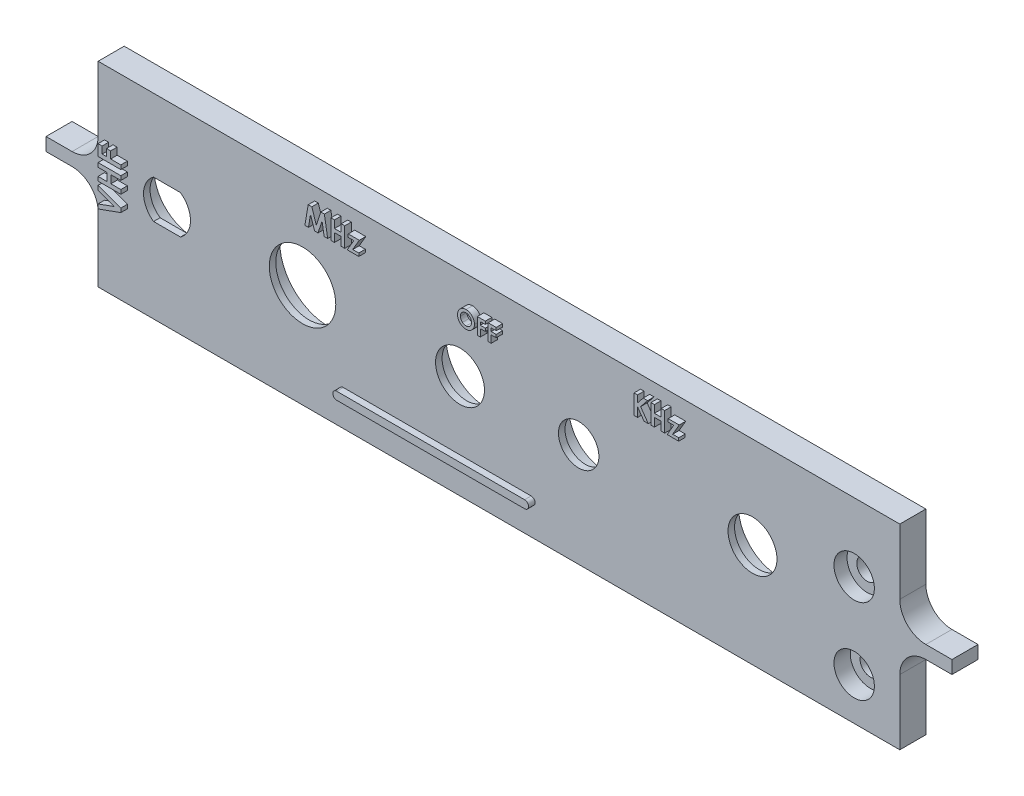
from build123d import *

# Parameters (mm, degrees)
SKETCH1_R           = 1.6
SKETCH1_R_2         = 3.75
SKETCH1_R_3         = 3.1
SKETCH1_R_4         = 5.1
BOSS_EXTRUDE1_DEPTH = 4
TEXTOS_DEPTH        = 1
SKETCH5_R           = 6
SKETCH5_R_2         = 7.5
SKETCH5_R_3         = 6.15
SKETCH5_R_4         = 5.5
CUT_EXTRUDE1_DEPTH  = 3
SKETCH6_R           = 3.1
CUT_EXTRUDE2_DEPTH  = 2
SKETCH6_3_R         = 3.1
SKETCH6_3_R_2       = 0.1
CUT_EXTRUDE3_DEPTH  = 2.5


with BuildPart() as part:
    # Sketch1 → Boss-Extrude1 (new body)
    with BuildSketch(Plane.XY):
        with BuildLine():
            Line((8, 0), (131, 0))
            Line((131, 0), (131, 10))
            ThreePointArc((131, 10), (132.171572875, 12.828427125), (135, 14))
            Line((135, 14), (139, 14))
            Line((139, 14), (139, 16))
            Line((139, 16), (135, 16))
            ThreePointArc((135, 16), (132.171572875, 17.171572875), (131, 20))
            Line((131, 20), (131, 30))
            Line((131, 30), (8, 30))
            Line((8, 30), (8, 20))
            ThreePointArc((8, 20), (6.828427125, 17.171572875), (4, 16))
            Line((4, 16), (0, 16))
            Line((0, 16), (0, 14))
            Line((0, 14), (4, 14))
            ThreePointArc((4, 14), (6.828427125, 12.828427125), (8, 10))
            Line((8, 10), (8, 0))
        make_face()
        with Locations((124, 19.5)):
            Circle(SKETCH1_R, mode=Mode.SUBTRACT)
        with Locations((108.399727047, 15.906458033)):
            Circle(SKETCH1_R_2, mode=Mode.SUBTRACT)
        with Locations((81.730883445, 15.906458033)):
            Circle(SKETCH1_R_3, mode=Mode.SUBTRACT)
        with Locations((63.522500572, 15.906458033)):
            Circle(SKETCH1_R_2, mode=Mode.SUBTRACT)
        with Locations((39.361239448, 15.906458033)):
            Circle(SKETCH1_R_4, mode=Mode.SUBTRACT)
        with Locations((124, 6.5)):
            Circle(SKETCH1_R, mode=Mode.SUBTRACT)
        with BuildLine():
            Line((16.505280772, 12.956458033), (20.632022828, 12.956458033))
            ThreePointArc((20.632022828, 12.956458033), (22.1686518, 15.906458033), (20.632022828, 18.856458033))
            Line((20.632022828, 18.856458033), (16.505280772, 18.856458033))
            ThreePointArc((16.505280772, 18.856458033), (14.9686518, 15.906458033), (16.505280772, 12.956458033))
        make_face(mode=Mode.SUBTRACT)
    extrude(amount=BOSS_EXTRUDE1_DEPTH)

    # Sketch4 → Textos (add)
    # profile 1 of 13: a face of its own
    with BuildSketch(Plane.XY.offset(4)):
        with BuildLine():
            Line((45.611678431, 4.253639523), (74.442135338, 4.253639523))
            ThreePointArc((74.442135338, 4.253639523), (75.042135338, 4.853639523), (74.442135338, 5.453639523))
            Line((74.442135338, 5.453639523), (45.611678431, 5.453639523))
            ThreePointArc((45.611678431, 5.453639523), (45.011678431, 4.853639523), (45.611678431, 4.253639523))
        make_face()
    # profile 2 of 13: a face of its own
    with BuildSketch(Plane.XY.offset(4)):
        Polygon((8.98385161, 18.336657969), (8.98385161, 20.041786174), (9.612056738, 20.041786174), (9.612056738, 18.964863097), (10.285133661, 18.964863097), (10.285133661, 20.041786174), (10.913338789, 20.041786174), (10.913338789, 18.964863097), (12.48385161, 18.964863097), (12.48385161, 18.336657969), align=None)
    # profile 3 of 13: a face of its own
    with BuildSketch(Plane.XY.offset(4)):
        Polygon((8.98385161, 15.061016943), (8.98385161, 15.689222071), (10.330005456, 15.689222071), (10.330005456, 16.900760533), (8.98385161, 16.900760533), (8.98385161, 17.528965661), (12.48385161, 17.528965661), (12.48385161, 16.900760533), (10.958210584, 16.900760533), (10.958210584, 15.689222071), (12.48385161, 15.689222071), (12.48385161, 15.061016943), align=None)
    # profile 4 of 13: a face of its own
    with BuildSketch(Plane.XY.offset(4)):
        Polygon((8.98385161, 11.359093866), (8.98385161, 12.030067424), (11.470029494, 12.929606687), (8.98385161, 13.829847071), (8.98385161, 14.500119507), (12.48385161, 13.23179018), (12.48385161, 12.62602095), align=None)
    # profile 5 of 13: a face of its own
    with BuildSketch(Plane.XY.offset(4)):
        with BuildLine():
            add(Edge.make_bspline(
                [(65.445649566, 26.23282431), (65.48911513, 26.231698909), (65.574925998, 26.229477111), (65.701122819, 26.210956699), (65.82273679, 26.180780342), (65.939712916, 26.138833024), (66.051758305, 26.083978597), (66.159268176, 26.017772221), (66.261857435, 25.938964289), (66.35847483, 25.849393262), (66.447766728, 25.751988681), (66.525138209, 25.647115332), (66.59111777, 25.53749059), (66.645801807, 25.422820711), (66.687453879, 25.302311552), (66.716682861, 25.17657755), (66.735461034, 25.045654476), (66.737620813, 24.956513707), (66.738718477, 24.911209726)],
                knots=[0, 0, 0, 0, 1.014329547, 2.002516266, 2.970391464, 3.935626869, 4.897733899, 5.877609409, 6.878433252, 7.912639331, 8.949961323, 9.958554974, 10.949718813, 11.932905612, 12.9188844, 13.919928257, 14.942845884, 16, 16, 16, 16], degree=3))
            add(Edge.make_bspline(
                [(66.738718477, 24.911209726), (66.737549512, 24.866416217), (66.735246031, 24.778149169), (66.717449469, 24.648432602), (66.687728267, 24.524045474), (66.646782646, 24.40470623), (66.593090371, 24.290992909), (66.528397483, 24.182179468), (66.450996861, 24.079275722), (66.363711607, 23.982336891), (66.267618118, 23.894344102), (66.165839859, 23.816800608), (66.058846778, 23.751093177), (65.94679548, 23.697251908), (65.829445675, 23.655467681), (65.707087233, 23.625985873), (65.579727724, 23.608069183), (65.493117081, 23.605780748), (65.449155175, 23.604619182)],
                knots=[0, 0, 0, 0, 1.051557043, 2.072126891, 3.067553643, 4.050577992, 5.02905126, 6.015227836, 7.017913613, 8.04756643, 9.074058332, 10.072836633, 11.047628519, 12.017157415, 12.98668631, 13.966869689, 14.968021931, 16, 16, 16, 16], degree=3))
            add(Edge.make_bspline(
                [(65.449155175, 23.604619182), (65.403176293, 23.605661164), (65.312834074, 23.607708516), (65.180617832, 23.627177901), (65.053943248, 23.656505596), (64.933874461, 23.700275608), (64.819188673, 23.754991804), (64.710728514, 23.822378079), (64.608530435, 23.902323073), (64.513180659, 23.992779364), (64.426793532, 24.091758387), (64.350539947, 24.196320947), (64.286218357, 24.305668279), (64.233826407, 24.419851559), (64.192522699, 24.538161166), (64.163387626, 24.66131764), (64.146176843, 24.789025607), (64.143779481, 24.87576741), (64.142564631, 24.919723348)],
                knots=[0, 0, 0, 0, 1.067978421, 2.098431617, 3.099715153, 4.085208694, 5.062210972, 6.048429807, 7.046490867, 8.072918869, 9.098532598, 10.095778865, 11.076610158, 12.041847152, 13.011192615, 13.984257998, 14.978533688, 16, 16, 16, 16], degree=3))
            add(Edge.make_bspline(
                [(64.142564631, 24.919723348), (64.142945921, 24.949294602), (64.143703673, 25.00806267), (64.152831593, 25.095153947), (64.165973175, 25.180545319), (64.18540895, 25.26389633), (64.20901845, 25.345794982), (64.239607892, 25.425478942), (64.274426955, 25.503799454), (64.315109752, 25.579831455), (64.360345089, 25.652875387), (64.409700868, 25.722586688), (64.463301196, 25.788122448), (64.520973406, 25.84991334), (64.582916245, 25.907553209), (64.64831492, 25.961858026), (64.718437784, 26.011385263), (64.791750066, 26.057344474), (64.867838451, 26.098904592), (64.946393188, 26.134279321), (65.025795895, 26.165171469), (65.107107285, 26.189552919), (65.189455962, 26.209411354), (65.273721655, 26.222544078), (65.35914307, 26.231671746), (65.416745635, 26.23243921), (65.445649566, 26.23282431)],
                knots=[0, 0, 0, 0, 1.034744296, 2.056386356, 3.06226378, 4.057406941, 5.050368692, 6.043467995, 7.042652155, 8.049140477, 9.059438543, 10.048523776, 11.036952808, 12.020949711, 13.004946614, 13.997082645, 14.994316842, 16.007702937, 17.024872941, 18.026463647, 19.021641123, 20.005082605, 20.995858141, 21.984425357, 22.988620895, 24, 24, 24, 24], degree=3))
        make_face()
        with BuildLine():
            add(Edge.make_bspline(
                [(65.438638348, 25.784106361), (65.40938603, 25.783321456), (65.351653658, 25.781772367), (65.266970783, 25.769970402), (65.185672233, 25.751121324), (65.108208676, 25.723818665), (65.034244381, 25.689069309), (64.96364823, 25.646994674), (64.897397835, 25.596148494), (64.834609811, 25.539260471), (64.777891163, 25.47587414), (64.727778448, 25.407944906), (64.685842177, 25.335586211), (64.650720287, 25.259470249), (64.624281288, 25.178741116), (64.605449582, 25.094031172), (64.593548647, 25.005194459), (64.592048519, 24.944634587), (64.591282579, 24.913713733)],
                knots=[0, 0, 0, 0, 1.033739768, 2.040188636, 3.016340934, 3.979330865, 4.937572243, 5.900995986, 6.878200029, 7.884839167, 8.891893314, 9.879764717, 10.863503415, 11.843163062, 12.837761627, 13.859916423, 14.907309254, 16, 16, 16, 16], degree=3))
            add(Edge.make_bspline(
                [(64.591282579, 24.913713733), (64.592298099, 24.879446471), (64.594288349, 24.812288316), (64.60829199, 24.714319809), (64.632250825, 24.621798277), (64.666846918, 24.53517623), (64.70975515, 24.453491794), (64.763040364, 24.377746129), (64.825839592, 24.307485704), (64.874219608, 24.266464742), (64.898774566, 24.245644823)],
                knots=[0, 0, 0, 0, 1.078454662, 2.113592447, 3.107694534, 4.079536787, 5.043276885, 6.005368276, 6.987637804, 8, 8, 8, 8], degree=3))
            add(Edge.make_bspline(
                [(64.898774566, 24.245644823), (64.918889765, 24.230263866), (64.958666964, 24.199848488), (65.022160034, 24.160864942), (65.087545394, 24.127452153), (65.155316458, 24.100455016), (65.225330097, 24.079219521), (65.29757671, 24.064348654), (65.37195393, 24.055015898), (65.422251292, 24.053900457), (65.447652772, 24.05333713)],
                knots=[0, 0, 0, 0, 1.023928204, 2.024787132, 3.009472467, 3.9914905, 4.972207045, 5.96565515, 6.972602802, 8, 8, 8, 8], degree=3))
            add(Edge.make_bspline(
                [(65.447652772, 24.05333713), (65.476402096, 24.054128691), (65.532967296, 24.055686111), (65.616073754, 24.067342787), (65.695692264, 24.08707009), (65.772317106, 24.114133241), (65.845727327, 24.149318905), (65.915564153, 24.192698563), (65.981950025, 24.243739567), (66.044658058, 24.301374654), (66.101976165, 24.365010683), (66.151984305, 24.433302244), (66.19525394, 24.50474467), (66.229645469, 24.580349119), (66.257129013, 24.65940192), (66.275734069, 24.742253183), (66.287735541, 24.828561362), (66.289236091, 24.887297128), (66.290000528, 24.917219342)],
                knots=[0, 0, 0, 0, 1.026359118, 2.019393844, 2.989460624, 3.950973911, 4.916101784, 5.890408035, 6.881132271, 7.902007068, 8.92769091, 9.933912415, 10.920395702, 11.90457117, 12.894218921, 13.903490204, 14.931958862, 16, 16, 16, 16], degree=3))
            add(Edge.make_bspline(
                [(66.290000528, 24.917219342), (66.289209641, 24.946969495), (66.287652902, 25.005528133), (66.27597571, 25.091614415), (66.256373512, 25.174099913), (66.229229093, 25.253119337), (66.194567108, 25.328750153), (66.151704047, 25.400726401), (66.100790311, 25.468978495), (66.042997677, 25.533041324), (65.980093947, 25.591910961), (65.912560507, 25.642999104), (65.84228702, 25.687393076), (65.767661067, 25.722169522), (65.690209435, 25.749875842), (65.609459508, 25.770279173), (65.525105442, 25.781689457), (65.467717627, 25.783293545), (65.438638348, 25.784106361)],
                knots=[0, 0, 0, 0, 1.055025985, 2.07665775, 3.074803781, 4.057872707, 5.035505728, 6.020516407, 7.023567878, 8.050795229, 9.077271434, 10.074415901, 11.050397877, 12.019801805, 12.988065821, 13.964604439, 14.968634123, 16, 16, 16, 16], degree=3))
        make_face(mode=Mode.SUBTRACT)
    # profile 6 of 13: a face of its own
    with BuildSketch(Plane.XY.offset(4)):
        Polygon((67.187436425, 26.168721746), (68.405385143, 26.168721746), (68.405385143, 25.720003797), (67.636154374, 25.720003797), (67.636154374, 25.239234566), (68.405385143, 25.239234566), (68.405385143, 24.790516618), (67.636154374, 24.790516618), (67.636154374, 23.668721746), (67.187436425, 23.668721746), align=None)
    # profile 7 of 13: a face of its own
    with BuildSketch(Plane.XY.offset(4)):
        Polygon((68.854103092, 26.168721746), (70.07205181, 26.168721746), (70.07205181, 25.720003797), (69.302821041, 25.720003797), (69.302821041, 25.239234566), (70.07205181, 25.239234566), (70.07205181, 24.790516618), (69.302821041, 24.790516618), (69.302821041, 23.668721746), (68.854103092, 23.668721746), align=None)
    # profile 8 of 13: a face of its own
    with BuildSketch(Plane.XY.offset(4)):
        Polygon((41.22688513, 28.048144691), (41.784577438, 28.048144691), (42.470274553, 25.955596614), (43.159577438, 28.048144691), (43.713063015, 28.048144691), (44.220274553, 25.048144691), (43.675202438, 25.048144691), (43.354889938, 26.942976421), (42.731091861, 25.048144691), (42.206452438, 25.048144691), (41.585659169, 26.942976421), (41.26594763, 25.048144691), (40.720274553, 25.048144691), align=None)
    # profile 9 of 13: a face of its own
    with BuildSketch(Plane.XY.offset(4)):
        Polygon((44.720274553, 28.048144691), (45.258736092, 28.048144691), (45.258736092, 26.894298537), (46.29719763, 26.894298537), (46.29719763, 28.048144691), (46.835659169, 28.048144691), (46.835659169, 25.048144691), (46.29719763, 25.048144691), (46.29719763, 26.355836998), (45.258736092, 26.355836998), (45.258736092, 25.048144691), (44.720274553, 25.048144691), align=None)
    # profile 10 of 13: a face of its own
    with BuildSketch(Plane.XY.offset(4)):
        Polygon((47.374120707, 27.240452383), (49.066428399, 27.240452383), (48.058615899, 25.509683152), (48.989505322, 25.509683152), (48.989505322, 25.048144691), (47.220274553, 25.048144691), (48.227486092, 26.778913921), (47.374120707, 26.778913921), align=None)
    # profile 11 of 13: a face of its own
    with BuildSketch(Plane.XY.offset(4)):
        Polygon((91.233249776, 28.048144691), (91.771711314, 28.048144691), (91.771711314, 26.992255268), (92.622672853, 28.048144691), (93.302360353, 28.048144691), (92.233249776, 26.721221614), (93.406326699, 25.048144691), (92.757889199, 25.048144691), (91.771711314, 26.454995652), (91.771711314, 25.048144691), (91.233249776, 25.048144691), align=None)
    # profile 12 of 13: a face of its own
    with BuildSketch(Plane.XY.offset(4)):
        Polygon((93.810172853, 28.048144691), (94.348634391, 28.048144691), (94.348634391, 26.894298537), (95.387095929, 26.894298537), (95.387095929, 28.048144691), (95.925557468, 28.048144691), (95.925557468, 25.048144691), (95.387095929, 25.048144691), (95.387095929, 26.355836998), (94.348634391, 26.355836998), (94.348634391, 25.048144691), (93.810172853, 25.048144691), align=None)
    # profile 13 of 13: a face of its own
    with BuildSketch(Plane.XY.offset(4)):
        Polygon((96.464019006, 27.240452383), (98.156326699, 27.240452383), (97.148514199, 25.509683152), (98.079403622, 25.509683152), (98.079403622, 25.048144691), (96.310172853, 25.048144691), (97.317384391, 26.778913921), (96.464019006, 26.778913921), align=None)
    extrude(amount=TEXTOS_DEPTH)

    # Sketch5 → Cut-Extrude1 (cut)
    with BuildSketch(Plane(origin=(0, 0, 0), x_dir=(-1, 0, 0), z_dir=(0, 0, -1))):
        with Locations((-18.5686518, 15.906458033)):
            Circle(SKETCH5_R)
        with Locations((-39.361239448, 15.906458033)):
            Circle(SKETCH5_R_2)
        with Locations((-63.522500572, 15.906458033)):
            Circle(SKETCH5_R_3)
        with Locations((-81.730883445, 15.906458033)):
            Circle(SKETCH5_R_4)
        with Locations((-108.399727047, 15.906458033)):
            Circle(SKETCH5_R_3)
    extrude(amount=-CUT_EXTRUDE1_DEPTH, mode=Mode.SUBTRACT)

    # Sketch6 → Cut-Extrude2 (cut)
    with BuildSketch(Plane.XY.offset(4)):
        with Locations((124, 19.5)):
            Circle(SKETCH6_R)
    extrude(amount=-CUT_EXTRUDE2_DEPTH, mode=Mode.SUBTRACT)

    # Sketch6<3> → Cut-Extrude3 (cut)
    with BuildSketch(Plane.XY.offset(4)):
        with Locations((124, 6.5)):
            Circle(SKETCH6_3_R)
        with Locations((124, 6.5)):
            Circle(SKETCH6_3_R_2, mode=Mode.SUBTRACT)
    extrude(amount=-CUT_EXTRUDE3_DEPTH, mode=Mode.SUBTRACT)


solid = part.part
